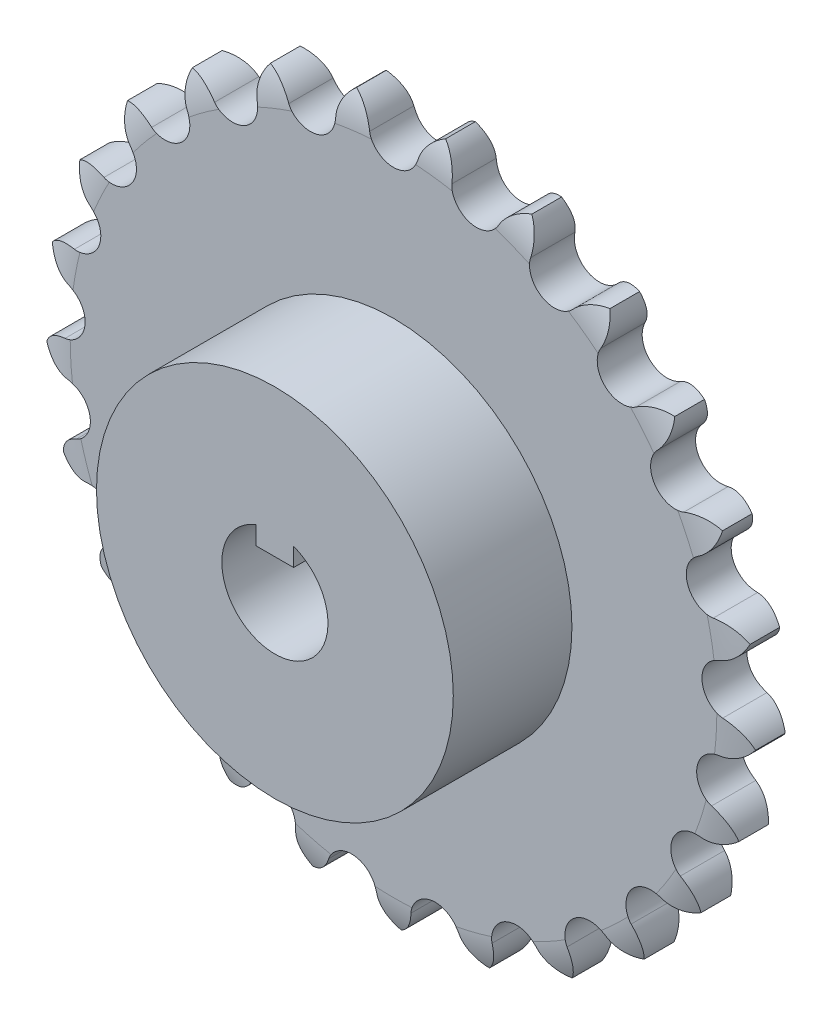
from build123d import *

# Parameters (mm, degrees)
CROQUIS1_R                   = 19
SALIENTE_EXTRUIR1_DEPTH      = 3.6
CROQUIS2_R                   = 28.575
CROQUIS2_R_2                 = 19
SALIENTE_EXTRUIR2_DEPTH      = 19
CROQUIS3_W                   = 9.5
CROQUIS3_H                   = 4.8
CORTAR_EXTRUIR1_DEPTH        = 85.518395836
SALIENTE_EXTRUIR4_DEPTH      = 4
SALIENTE_EXTRUIR4_DEPTH_BACK = 70.2
CORTAR_EXTRUIR2_DEPTH        = 128
CORTAR_EXTRUIR3_DEPTH        = 44
CROQUIS9_R                   = 28.434294666
CORTAR_EXTRUIR4_DEPTH        = 4


with BuildPart() as part:
    # Croquis1 → Saliente-Extruir1 (new, symmetric)
    with BuildSketch(Plane.XY):
        with BuildLine():
            ThreePointArc((3.880781439, 52.530703644), (0, 49.5), (-3.880781439, 52.530703644))
            ThreePointArc((-3.880781439, 52.530703644), (-5.058625162, 54.850631023), (-7.128405784, 56.427142063))
            ThreePointArc((-7.128405784, 56.427142063), (-8.741098089, 54.385426507), (-9.304995208, 51.84546609))
            ThreePointArc((-9.304995208, 51.84546609), (-12.310149415, 47.944866476), (-16.822714315, 49.915243894))
            ThreePointArc((-16.822714315, 49.915243894), (-18.540496391, 51.869368666), (-20.937313401, 52.881617202))
            ThreePointArc((-20.937313401, 52.881617202), (-21.991586001, 50.502985628), (-21.906104785, 47.902587227))
            ThreePointArc((-21.906104785, 47.902587227), (-23.846806868, 43.377180662), (-28.707614182, 44.163425794))
            ThreePointArc((-28.707614182, 44.163425794), (-30.857400044, 45.628963112), (-33.430652615, 46.013345848))
            ThreePointArc((-33.430652615, 46.013345848), (-33.860261684, 43.447256425), (-33.130773233, 40.949812636))
            ThreePointArc((-33.130773233, 40.949812636), (-33.885081743, 36.083947057), (-38.788709071, 35.63665723))
            ThreePointArc((-38.788709071, 35.63665723), (-41.235419766, 36.521521995), (-43.823420975, 36.253886749))
            ThreePointArc((-43.823420975, 36.253886749), (-43.601372597, 33.661576313), (-42.273713353, 31.424010713))
            ThreePointArc((-42.273713353, 31.424010713), (-41.794232312, 26.523426351), (-46.432566713, 24.87070643))
            ThreePointArc((-46.432566713, 24.87070643), (-49.022466412, 25.119299335), (-51.462602625, 24.216462613))
            ThreePointArc((-51.462602625, 24.216462613), (-50.602848914, 21.760815562), (-48.76044059, 19.923722628))
            ThreePointArc((-48.76044059, 19.923722628), (-47.077297557, 15.296341222), (-51.158895422, 12.542037677))
            ThreePointArc((-51.158895422, 12.542037677), (-53.729251201, 12.138738714), (-55.868199685, 10.657429069))
            ThreePointArc((-55.868199685, 10.657429069), (-54.42476213, 8.49274274), (-52.183370017, 7.171553776))
            ThreePointArc((-52.183370017, 7.171553776), (-49.402323057, 3.108130717), (-52.670722583, -0.57469343))
            ThreePointArc((-52.670722583, -0.57469343), (-55.060029534, -1.604543503), (-56.76339229, -3.571249938))
            ThreePointArc((-56.76339229, -3.571249938), (-54.826967381, -5.308960344), (-52.327426389, -6.031230175))
            ThreePointArc((-52.327426389, -6.031230175), (-48.623218911, -9.275375072), (-50.873054534, -13.655314435))
            ThreePointArc((-50.873054534, -13.655314435), (-52.931183716, -15.24700635), (-54.091932197, -17.575534178))
            ThreePointArc((-54.091932197, -17.575534178), (-51.784192633, -18.777081924), (-49.183558114, -18.855049753))
            ThreePointArc((-49.183558114, -18.855049753), (-44.788939097, -21.076074932), (-45.878845371, -25.877921813))
            ThreePointArc((-45.878845371, -25.877921813), (-47.476476957, -27.931443714), (-48.021677067, -30.475482967))
            ThreePointArc((-48.021677067, -30.475482967), (-45.487626612, -31.065370389), (-42.949305998, -30.49413721))
            ThreePointArc((-42.949305998, -30.49413721), (-38.140405517, -31.552487493), (-38.001899622, -36.474524192))
            ThreePointArc((-38.001899622, -36.474524192), (-39.038648544, -38.860845745), (-38.934043356, -41.46054508))
            ThreePointArc((-38.934043356, -41.46054508), (-36.332905719, -41.401707383), (-34.01639103, -40.217165878))
            ThreePointArc((-34.01639103, -40.217165878), (-29.095369988, -40.046341222), (-27.737154759, -44.779298072))
            ThreePointArc((-27.737154759, -44.779298072), (-28.14787827, -47.348477917), (-27.400040511, -49.840488665))
            ThreePointArc((-27.400040511, -49.840488665), (-24.895254737, -49.136622836), (-22.94610111, -47.413202104))
            ThreePointArc((-22.94610111, -47.413202104), (-18.222165358, -46.023936051), (-15.729582453, -50.270423967))
            ThreePointArc((-15.729582453, -50.270423967), (-15.488473283, -52.861031087), (-14.144392351, -55.088771047))
            ThreePointArc((-14.144392351, -55.088771047), (-11.893343341, -53.784103566), (-10.434023267, -51.630092469))
            ThreePointArc((-10.434023267, -51.630092469), (-6.203995061, -49.109677715), (-2.733662631, -52.602874242))
            ThreePointArc((-2.733662631, -52.602874242), (-1.855870557, -55.052131263), (0, -56.875623341))
            ThreePointArc((0, -56.875623341), (1.855870557, -55.052131263), (2.733662631, -52.602874242))
            ThreePointArc((2.733662631, -52.602874242), (6.203995061, -49.109677715), (10.434023267, -51.630092469))
            ThreePointArc((10.434023267, -51.630092469), (11.893343341, -53.784103566), (14.144392351, -55.088771047))
            ThreePointArc((14.144392351, -55.088771047), (15.488473283, -52.861031087), (15.729582453, -50.270423967))
            ThreePointArc((15.729582453, -50.270423967), (18.222165358, -46.023936051), (22.94610111, -47.413202104))
            ThreePointArc((22.94610111, -47.413202104), (24.895254737, -49.136622836), (27.400040511, -49.840488665))
            ThreePointArc((27.400040511, -49.840488665), (28.14787827, -47.348477917), (27.737154759, -44.779298072))
            ThreePointArc((27.737154759, -44.779298072), (29.095369988, -40.046341222), (34.01639103, -40.217165878))
            ThreePointArc((34.01639103, -40.217165878), (36.332905719, -41.401707383), (38.934043356, -41.46054508))
            ThreePointArc((38.934043356, -41.46054508), (39.038648544, -38.860845745), (38.001899622, -36.474524192))
            ThreePointArc((38.001899622, -36.474524192), (38.140405517, -31.552487493), (42.949305998, -30.49413721))
            ThreePointArc((42.949305998, -30.49413721), (45.487626612, -31.065370389), (48.021677067, -30.475482967))
            ThreePointArc((48.021677067, -30.475482967), (47.476476957, -27.931443714), (45.878845371, -25.877921813))
            ThreePointArc((45.878845371, -25.877921813), (44.788939097, -21.076074932), (49.183558114, -18.855049753))
            ThreePointArc((49.183558114, -18.855049753), (51.784192633, -18.777081924), (54.091932197, -17.575534178))
            ThreePointArc((54.091932197, -17.575534178), (52.931183716, -15.24700635), (50.873054534, -13.655314435))
            ThreePointArc((50.873054534, -13.655314435), (48.623218911, -9.275375072), (52.327426389, -6.031230175))
            ThreePointArc((52.327426389, -6.031230175), (54.826967381, -5.308960344), (56.76339229, -3.571249938))
            ThreePointArc((56.76339229, -3.571249938), (55.060029534, -1.604543503), (52.670722583, -0.57469343))
            ThreePointArc((52.670722583, -0.57469343), (49.402323057, 3.108130717), (52.183370017, 7.171553776))
            ThreePointArc((52.183370017, 7.171553776), (54.42476213, 8.49274274), (55.868199685, 10.657429069))
            ThreePointArc((55.868199685, 10.657429069), (53.729251201, 12.138738714), (51.158895422, 12.542037677))
            ThreePointArc((51.158895422, 12.542037677), (47.077297557, 15.296341222), (48.76044059, 19.923722628))
            ThreePointArc((48.76044059, 19.923722628), (50.602848914, 21.760815562), (51.462602625, 24.216462613))
            ThreePointArc((51.462602625, 24.216462613), (49.022466412, 25.119299335), (46.432566713, 24.87070643))
            ThreePointArc((46.432566713, 24.87070643), (41.794232312, 26.523426351), (42.273713353, 31.424010713))
            ThreePointArc((42.273713353, 31.424010713), (43.601372597, 33.661576313), (43.823420975, 36.253886749))
            ThreePointArc((43.823420975, 36.253886749), (41.235419766, 36.521521995), (38.788709071, 35.63665723))
            ThreePointArc((38.788709071, 35.63665723), (33.885081743, 36.083947057), (33.130773233, 40.949812636))
            ThreePointArc((33.130773233, 40.949812636), (33.860261684, 43.447256425), (33.430652615, 46.013345848))
            ThreePointArc((33.430652615, 46.013345848), (30.857400044, 45.628963112), (28.707614182, 44.163425794))
            ThreePointArc((28.707614182, 44.163425794), (23.846806868, 43.377180662), (21.906104785, 47.902587227))
            ThreePointArc((21.906104785, 47.902587227), (21.991586001, 50.502985628), (20.937313401, 52.881617202))
            ThreePointArc((20.937313401, 52.881617202), (18.540496391, 51.869368666), (16.822714315, 49.915243894))
            ThreePointArc((16.822714315, 49.915243894), (12.310149415, 47.944866476), (9.304995208, 51.84546609))
            ThreePointArc((9.304995208, 51.84546609), (8.741098089, 54.385426507), (7.128405784, 56.427142063))
            ThreePointArc((7.128405784, 56.427142063), (5.058625162, 54.850631023), (3.880781439, 52.530703644))
        make_face()
        Circle(CROQUIS1_R, mode=Mode.SUBTRACT)
    extrude(amount=SALIENTE_EXTRUIR1_DEPTH, both=True)

    # Croquis2 → Saliente-Extruir2 (add)
    with BuildSketch(Plane.XY.offset(3.6)):
        Circle(CROQUIS2_R)
        Circle(CROQUIS2_R_2, mode=Mode.SUBTRACT)
    extrude(amount=SALIENTE_EXTRUIR2_DEPTH)

    # Croquis3 → Cortar-Extruir1 (cut, through all)
    with BuildSketch(Plane.XY.offset(22.6)):
        with Locations((0, 19)):
            Rectangle(CROQUIS3_W, CROQUIS3_H)
    extrude(amount=-CORTAR_EXTRUIR1_DEPTH, mode=Mode.SUBTRACT)

    # Croquis4 → Cortar-Revolución1 (revolve, cut)
    with BuildSketch(Plane(origin=(0, 0, 0), x_dir=(0, 0, -1), z_dir=(1, 0, 0))):
        with BuildLine():
            Line((-2.1, 57.427142063), (-9.350199674, 57.427142063))
            Line((-9.350199674, 57.427142063), (-9.350199674, 51.077142063))
            Line((-9.350199674, 51.077142063), (-3.6, 51.077142063))
            ThreePointArc((-3.6, 51.077142063), (-3.26475648, 54.350116034), (-2.1, 57.427142063))
        make_face()
        with BuildLine():
            Line((9.350199674, 51.077142063), (3.6, 51.077142063))
            ThreePointArc((3.6, 51.077142063), (3.26475648, 54.350116034), (2.1, 57.427142063))
            Line((2.1, 57.427142063), (9.350199674, 57.427142063))
            Line((9.350199674, 57.427142063), (9.350199674, 51.077142063))
        make_face()
    revolve(axis=Axis((0, 0, 81.57594022), (0, 0, -1)), mode=Mode.SUBTRACT)

    # Croquis5 → Saliente-Extruir4 (add, two sides: drawn at the far end of the back side and taken through both)
    with BuildSketch(Plane.XY.offset(22.6).offset(-SALIENTE_EXTRUIR4_DEPTH_BACK)):
        with BuildLine():
            Line((-4.75, 18.396670894), (-4.75, 21.4))
            Line((-4.75, 21.4), (4.75, 21.4))
            Line((4.75, 21.4), (4.75, 18.396670894))
            ThreePointArc((4.75, 18.396670894), (0, -19), (-4.75, 18.396670894))
        make_face()
    extrude(amount=SALIENTE_EXTRUIR4_DEPTH + SALIENTE_EXTRUIR4_DEPTH_BACK)

    # Croquis6 → Cortar-Extruir2 (cut)
    with BuildSketch(Plane(origin=(0, 0, -47.6), x_dir=(-1, 0, 0), z_dir=(0, 0, -1))):
        with BuildLine():
            Line((-3, 5.00298686), (-3, 7.95298686))
            ThreePointArc((-3, 7.95298686), (0, -8.5), (3, 7.95298686))
            Line((3, 7.95298686), (3, 5.00298686))
            Line((3, 5.00298686), (-3, 5.00298686))
        make_face()
    extrude(amount=-CORTAR_EXTRUIR2_DEPTH, mode=Mode.SUBTRACT)

    # Croquis8 → Cortar-Extruir3 (cut)
    with BuildSketch(Plane(origin=(0, 0, -47.6), x_dir=(-1, 0, 0), z_dir=(0, 0, -1))):
        with BuildLine():
            Line((-4.75, 18.396670894), (-4.75, 21.4))
            Line((-4.75, 21.4), (4.75, 21.4))
            Line((4.75, 21.4), (4.75, 18.396670894))
            ThreePointArc((4.75, 18.396670894), (0, -19), (-4.75, 18.396670894))
        make_face()
    extrude(amount=-CORTAR_EXTRUIR3_DEPTH, mode=Mode.SUBTRACT)

    # Croquis9 → Cortar-Extruir4 (cut)
    with BuildSketch(Plane.XY.offset(26.6)):
        Circle(CROQUIS9_R)
    extrude(amount=-CORTAR_EXTRUIR4_DEPTH, mode=Mode.SUBTRACT)


solid = part.part
